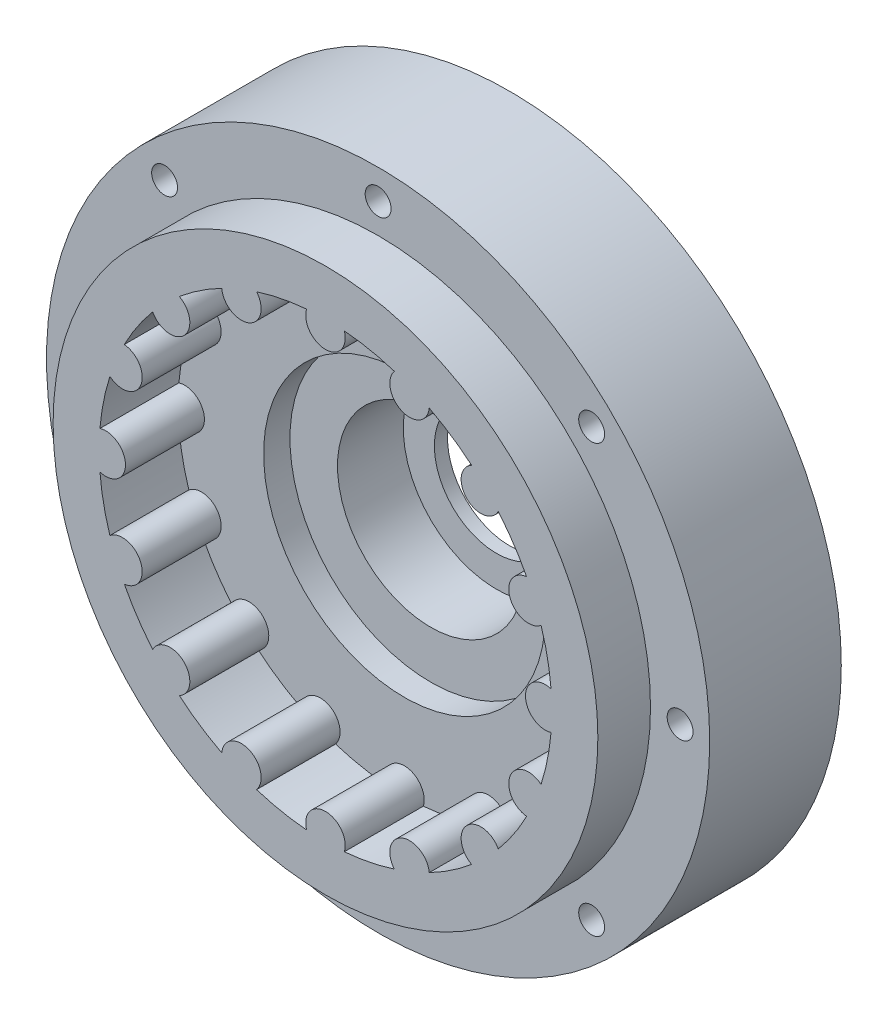
from build123d import *

# Parameters (mm, degrees)
SKETCH1_R             = 32.004
BOSS_EXTRUDE1_DEPTH   = 12.7
SKETCH2_OUTSIDE_W     = 84.29
SKETCH2_OUTSIDE_H     = 84.29
SKETCH2_OUTSIDE_R     = 32.004
SKETCH2_OUTSIDE_R_2   = 26.289
CUT_EXTRUDE1_DEPTH    = 2.54
SKETCH4_R             = 13.589
CUT_EXTRUDE3_DEPTH    = 2.54
SKETCH5_R             = 6
CUT_EXTRUDE4_DEPTH    = 46.897455616
M3X0_5_TAPPED_HOLE1_D = 2.5
SKETCH5_3_R           = 9
SKETCH5_3_R_2         = 6
CUT_EXTRUDE5_DEPTH    = 6.35
BOSS_EXTRUDE2_START   = 7.62
SKETCH8_R             = 26.289
SKETCH8_R_2           = 21.844
BOSS_EXTRUDE2_DEPTH   = 7.62
SKETCH3_R             = 1.905
BOSS_EXTRUDE3_DEPTH   = 7.62


with BuildPart() as part:
    # Sketch1 → Boss-Extrude1 (new body)
    with BuildSketch(Plane.XY):
        Circle(SKETCH1_R)
    extrude(amount=BOSS_EXTRUDE1_DEPTH)

    # Sketch2 outside → Cut-Extrude1 (cut)
    # profile 1 of 2: a face of its own
    with BuildSketch(Plane.XY.offset(12.7)):
        Rectangle(SKETCH2_OUTSIDE_W, SKETCH2_OUTSIDE_H)
        Circle(SKETCH2_OUTSIDE_R, mode=Mode.SUBTRACT)
    # profile 2 of 2: a face of its own
    with BuildSketch(Plane.XY.offset(12.7)):
        Circle(SKETCH2_OUTSIDE_R_2)
    extrude(amount=-CUT_EXTRUDE1_DEPTH, mode=Mode.SUBTRACT)

    # Sketch4 → Cut-Extrude3 (cut)
    with BuildSketch(Plane.XY.offset(10.16)):
        Circle(SKETCH4_R)
    extrude(amount=-CUT_EXTRUDE3_DEPTH, mode=Mode.SUBTRACT)

    # Sketch5 → Cut-Extrude4 (cut, through all)
    with BuildSketch(Plane.XY.offset(7.62)):
        Circle(SKETCH5_R)
    extrude(amount=-CUT_EXTRUDE4_DEPTH, mode=Mode.SUBTRACT)

    # M3x0.5 Tapped Hole1 (through all)
    with Locations(Plane.XY.offset(12.7)):
        with Locations((-20.609687798, 20.609687798), (0, 29.1465), (20.609687798, 20.609687798), (29.1465, 0), (20.609687798, -20.609687798), (0, -29.1465), (-20.609687798, -20.609687798), (-29.1465, 0)):
            Hole(M3X0_5_TAPPED_HOLE1_D / 2)

    # Sketch5<3> → Cut-Extrude5 (cut)
    with BuildSketch(Plane.XY.offset(7.62)):
        Circle(SKETCH5_3_R)
        Circle(SKETCH5_3_R_2, mode=Mode.SUBTRACT)
    extrude(amount=-CUT_EXTRUDE5_DEPTH, mode=Mode.SUBTRACT)

    # Sketch8 → Boss-Extrude2 (add)
    with BuildSketch(Plane.XY.offset(10.16).offset(BOSS_EXTRUDE2_START)):
        with Locations(Location((0, 0, 0), (0, 0, 180))):
            Circle(SKETCH8_R)
        with Locations(Location((0, 0, 0), (0, 0, 180))):
            Circle(SKETCH8_R_2, mode=Mode.SUBTRACT)
    extrude(amount=-BOSS_EXTRUDE2_DEPTH)

    # Sketch3 → Boss-Extrude3 (add)
    with BuildSketch(Plane.XY.offset(10.16)):
        with Locations((0, 21.209)):
            Circle(SKETCH3_R)
        with Locations((8.116332917, 19.594561005)):
            Circle(SKETCH3_R)
        with Locations((14.997027722, 14.997027722)):
            Circle(SKETCH3_R)
        with Locations((19.594561005, 8.116332917)):
            Circle(SKETCH3_R)
        with Locations((21.209, 0)):
            Circle(SKETCH3_R)
        with Locations((19.594561005, -8.116332917)):
            Circle(SKETCH3_R)
        with Locations((14.997027722, -14.997027722)):
            Circle(SKETCH3_R)
        with Locations((8.116332917, -19.594561005)):
            Circle(SKETCH3_R)
        with Locations((0, -21.209)):
            Circle(SKETCH3_R)
        with Locations((-8.116332917, -19.594561005)):
            Circle(SKETCH3_R)
        with Locations((-14.997027722, -14.997027722)):
            Circle(SKETCH3_R)
        with Locations((-19.594561005, -8.116332917)):
            Circle(SKETCH3_R)
        with Locations((-21.209, 0)):
            Circle(SKETCH3_R)
        with Locations((-19.594561005, 8.116332917)):
            Circle(SKETCH3_R)
        with Locations((-14.997027722, 14.997027722)):
            Circle(SKETCH3_R)
        with Locations((-8.116332917, 19.594561005)):
            Circle(SKETCH3_R)
    extrude(amount=BOSS_EXTRUDE3_DEPTH)


solid = part.part
